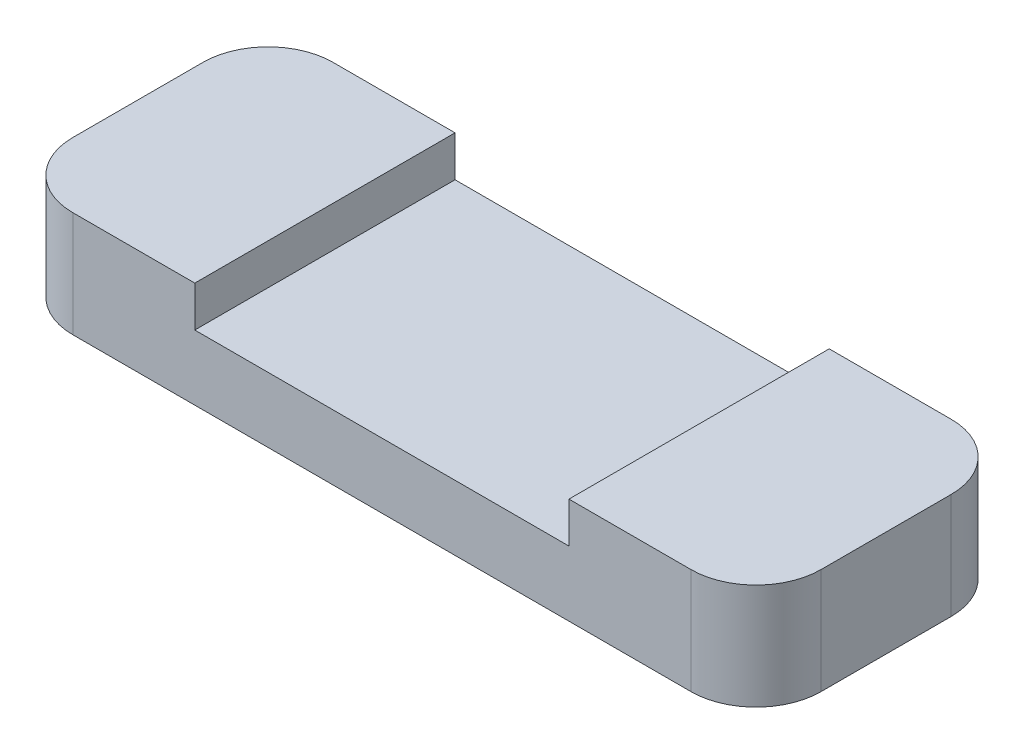
from build123d import *

# Parameters (mm, degrees)
SALIENTE_EXTRUIR1_DEPTH      = 4.5
SALIENTE_EXTRUIR1_DEPTH_BACK = 2
CROQUIS2_W                   = 23
CROQUIS2_H                   = 20.20150629
CORTAR_EXTRUIR1_DEPTH        = 2.5


with BuildPart() as part:
    # Croquis1 → Saliente-Extruir1 (new, two sides: drawn at the far end of the back side and taken through both)
    with BuildSketch(Plane(origin=(0, 0, 0), x_dir=(1, 0, 0), z_dir=(0, 1, 0)).offset(-SALIENTE_EXTRUIR1_DEPTH_BACK)):
        with BuildLine():
            Line((-19, 8), (19, 8))
            ThreePointArc((19, 8), (21.828427125, 6.828427125), (23, 4))
            Line((23, 4), (23, -4))
            ThreePointArc((23, -4), (21.828427125, -6.828427125), (19, -8))
            Line((19, -8), (-19, -8))
            ThreePointArc((-19, -8), (-21.828427125, -6.828427125), (-23, -4))
            Line((-23, -4), (-23, 4))
            ThreePointArc((-23, 4), (-21.828427125, 6.828427125), (-19, 8))
        make_face()
    extrude(amount=SALIENTE_EXTRUIR1_DEPTH + SALIENTE_EXTRUIR1_DEPTH_BACK)

    # Croquis2 → Cortar-Extruir1 (cut)
    with BuildSketch(Plane(origin=(0, 4.5, 0), x_dir=(1, 0, 0), z_dir=(0, 1, 0))):
        Rectangle(CROQUIS2_W, CROQUIS2_H)
    extrude(amount=-CORTAR_EXTRUIR1_DEPTH, mode=Mode.SUBTRACT)


solid = part.part
